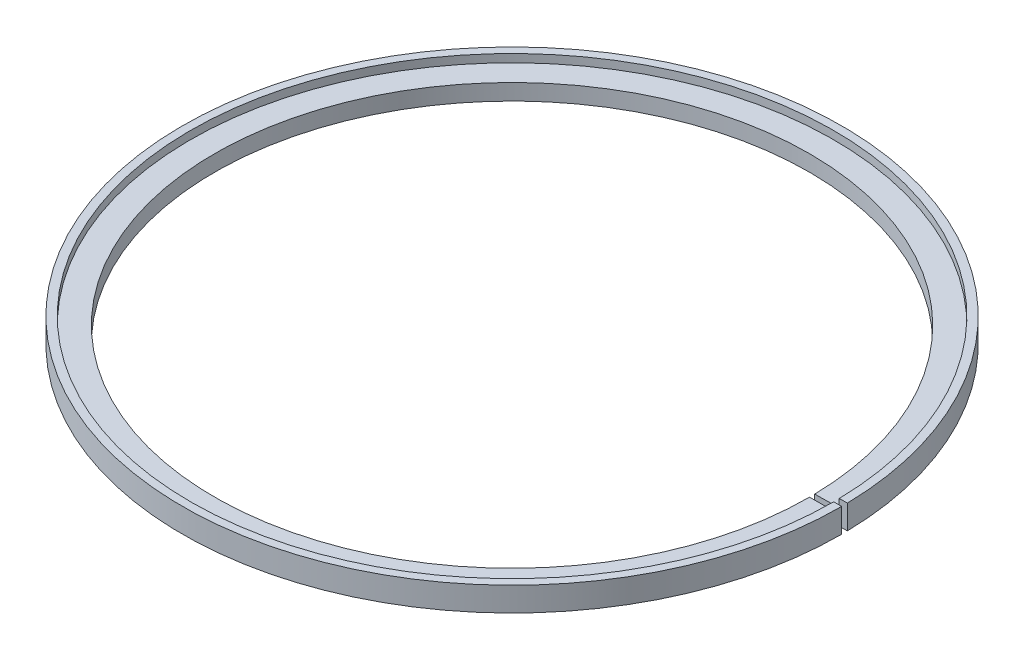
from build123d import *

# Parameters (mm, degrees)
REVOLVE_1_ANGLE = 359


with BuildPart() as part:
    # 草图1 → 旋转1 (revolve)
    with BuildSketch(Plane.XY):
        Polygon((40, 3), (41, 3), (41, 0), (37, 0), (37, 2), (40, 2), align=None)
    revolve(axis=Axis((0, 10, 0), (0, -1, 0)), revolution_arc=REVOLVE_1_ANGLE)


solid = part.part
